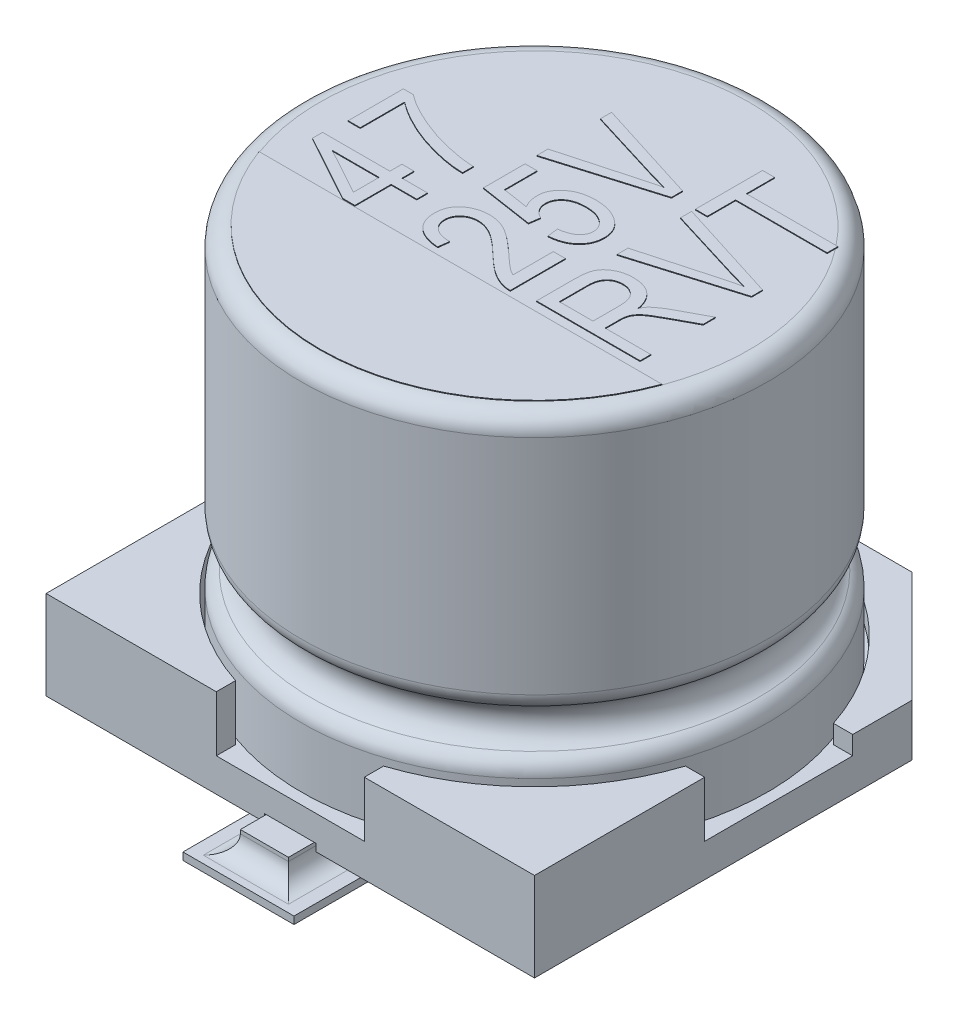
from build123d import *

# Parameters (mm, degrees)
SKETCH1_W                = 6.6
SKETCH1_H                = 6.6
BOSS_EXTRUDE1_DEPTH      = 1.2
CUT_EXTRUDE1_DEPTH       = 0.75
CUT_EXTRUDE2_DEPTH       = 5.902040392
CUT_EXTRUDE2_DEPTH_BACK  = 5.902040392
SKETCH3_W                = 3.3
SKETCH3_H                = 0.5
CHAMFER1_SIZE            = 1.5
CUT_EXTRUDE3_DEPTH       = 0.1
BOSS_EXTRUDE4_DEPTH      = 0.3
BOSS_EXTRUDE4_DEPTH_BACK = 0.1
SKETCH8_R                = 0.5
BOSS_EXTRUDE5_DEPTH      = 0.3
SKETCH9_W                = 1.5
SKETCH9_H                = 2
BOSS_EXTRUDE6_DEPTH      = 0.1
FILLET1_R                = 0.25
BOSS_EXTRUDE7_DEPTH      = 0.01


with BuildPart() as part:
    # Sketch1 → Boss-Extrude1 (new body)
    with BuildSketch(Plane(origin=(0, 0.3, 0), x_dir=(1, 0, 0), z_dir=(0, 1, 0))):
        Rectangle(SKETCH1_W, SKETCH1_H)
    extrude(amount=BOSS_EXTRUDE1_DEPTH)

    # Sketch2 → Cut-Extrude1 (cut)
    with BuildSketch(Plane(origin=(0, 1.5, 0), x_dir=(1, 0, 0), z_dir=(0, 1, 0))):
        with BuildLine():
            Line((-3.3, 1), (-3.039736831, 1))
            ThreePointArc((-3.039736831, 1), (-2.2627417, 2.2627417), (-1, 3.039736831))
            Line((-1, 3.039736831), (-1, 3.3))
            Line((-1, 3.3), (1, 3.3))
            Line((1, 3.3), (1, 3.039736831))
            ThreePointArc((1, 3.039736831), (2.2627417, 2.2627417), (3.039736831, 1))
            Line((3.039736831, 1), (3.3, 1))
            Line((3.3, 1), (3.3, -1))
            Line((3.3, -1), (3.039736831, -1))
            ThreePointArc((3.039736831, -1), (2.2627417, -2.2627417), (1, -3.039736831))
            Line((1, -3.039736831), (1, -3.3))
            Line((1, -3.3), (-1, -3.3))
            Line((-1, -3.3), (-1, -3.039736831))
            ThreePointArc((-1, -3.039736831), (-2.2627417, -2.2627417), (-3.039736831, -1))
            Line((-3.039736831, -1), (-3.3, -1))
            Line((-3.3, -1), (-3.3, 1))
        make_face()
    extrude(amount=-CUT_EXTRUDE1_DEPTH, mode=Mode.SUBTRACT)

    # Sketch3 → Cut-Extrude2 (cut, two sides: drawn at the far end of the back side and taken through both)
    with BuildSketch(Plane(origin=(0, 0, 0), x_dir=(0, 0, -1), z_dir=(1, 0, 0)).offset(-CUT_EXTRUDE2_DEPTH_BACK)):
        with Locations((1.65, 1.25)):
            Rectangle(SKETCH3_W, SKETCH3_H)
    extrude(amount=CUT_EXTRUDE2_DEPTH + CUT_EXTRUDE2_DEPTH_BACK, mode=Mode.SUBTRACT)

    # Chamfer1
    chamfer1_edges = [part.edges().sort_by_distance(p)[0] for p in [
        (3.3, 0.65, -3.3),
        (-3.3, 0.65, -3.3),
    ]]
    chamfer(chamfer1_edges, length=CHAMFER1_SIZE)

    # Sketch7 → Cut-Extrude3 (cut)
    with BuildSketch(Plane.XZ.offset(-0.3)):
        with BuildLine():
            Line((-0.35, 3.3), (0.35, 3.3))
            Line((0.35, 3.3), (0.498675617, 1.261367968))
            ThreePointArc((0.498675617, 1.261367968), (0, 0.725), (-0.498675617, 1.261367968))
            Line((-0.498675617, 1.261367968), (-0.35, 3.3))
        make_face()
        with BuildLine():
            Line((-0.35, -3.3), (0.35, -3.3))
            Line((0.35, -3.3), (0.498675617, -1.261367968))
            ThreePointArc((0.498675617, -1.261367968), (0, -0.725), (-0.498675617, -1.261367968))
            Line((-0.498675617, -1.261367968), (-0.35, -3.3))
        make_face()
    extrude(amount=-CUT_EXTRUDE3_DEPTH, mode=Mode.SUBTRACT)

    # Sketch6 → Boss-Extrude4 (add, two sides: drawn at the far end of the back side and taken through both)
    with BuildSketch(Plane.XZ.offset(-0.3).offset(-BOSS_EXTRUDE4_DEPTH_BACK)):
        with BuildLine():
            Line((-0.325, -1.225), (-0.325, -3.65))
            Line((-0.325, -3.65), (0.325, -3.65))
            Line((0.325, -3.65), (0.325, -1.225))
            ThreePointArc((0.325, -1.225), (0, -0.9), (-0.325, -1.225))
        make_face()
        with BuildLine():
            Line((-0.325, 1.225), (-0.325, 3.65))
            Line((-0.325, 3.65), (0.325, 3.65))
            Line((0.325, 3.65), (0.325, 1.225))
            ThreePointArc((0.325, 1.225), (0, 0.9), (-0.325, 1.225))
        make_face()
    extrude(amount=BOSS_EXTRUDE4_DEPTH + BOSS_EXTRUDE4_DEPTH_BACK)

    # Sketch8 → Boss-Extrude5 (add)
    with BuildSketch(Plane.XZ.offset(-0.3)):
        with Locations(Location((-2, 2, 0), (0, 0, 270))):
            Circle(SKETCH8_R)
        with Locations(Location((2, 2, 0), (0, 0, 270))):
            Circle(SKETCH8_R)
        with Locations(Location((2, -2, 0), (0, 0, 270))):
            Circle(SKETCH8_R)
        with Locations(Location((-2, -2, 0), (0, 0, 270))):
            Circle(SKETCH8_R)
    extrude(amount=BOSS_EXTRUDE5_DEPTH)

    # Sketch9 → Boss-Extrude6 (add)
    with BuildSketch(Plane(origin=(0, 0, 0), x_dir=(1, 0, 0), z_dir=(0, 1, 0))):
        with Locations((0, 3)):
            Rectangle(SKETCH9_W, SKETCH9_H)
        with Locations((0, -3)):
            Rectangle(SKETCH9_W, SKETCH9_H)
    extrude(amount=BOSS_EXTRUDE6_DEPTH)

    # Fillet1
    fillet1_edges = [part.edges().sort_by_distance(p)[0] for p in [
        (0.325, 0.1, -2.825),
        (0, 0.1, -3.65),
        (-0.325, 0.1, -2.825),
        (-0.325, 0.1, 2.825),
        (0, 0.1, 3.65),
        (0.325, 0.1, 2.825),
    ]]
    fillet(fillet1_edges, radius=FILLET1_R)


with BuildPart() as body_2:
    # Sketch4 → Revolve1 (revolve)
    with BuildSketch(Plane(origin=(0, 0, 0), x_dir=(0, 0, -1), z_dir=(1, 0, 0)), mode=Mode.PRIVATE) as revolve1_sk:
        with BuildLine():
            Line((0, 0.75), (0, 5.8))
            Line((0, 5.8), (-2.9, 5.8))
            ThreePointArc((-2.9, 5.8), (-3.076776695, 5.726776695), (-3.15, 5.55))
            Line((-3.15, 5.55), (-3.15, 2.539897949))
            ThreePointArc((-3.15, 2.539897949), (-3.113200716, 2.409339707), (-3.013636364, 2.317217063))
            ThreePointArc((-3.013636364, 2.317217063), (-2.85, 2.05), (-3.013636364, 1.782782937))
            ThreePointArc((-3.013636364, 1.782782937), (-3.113200716, 1.690660293), (-3.15, 1.560102051))
            Line((-3.15, 1.560102051), (-3.15, 0.75))
            Line((-3.15, 0.75), (0, 0.75))
        make_face()
    revolve(revolve1_sk.sketch.rotate(Axis((0, 0, 0), (0, 1, 0)), 180), axis=Axis((0, 0, 0), (0, 1, 0)))

    # Sketch10 → Boss-Extrude7 (add)
    # profile 1 of 9: a face of its own
    with BuildSketch(Plane(origin=(0, 5.8, 0), x_dir=(1, 0, 0), z_dir=(0, 1, 0))):
        with BuildLine():
            Line((-2.722131518, -1), (2.722131518, -1))
            ThreePointArc((2.722131518, -1), (0, -2.9), (-2.722131518, -1))
        make_face()
    # profile 2 of 9: a face of its own
    with BuildSketch(Plane(origin=(0, 5.8, 0), x_dir=(1, 0, 0), z_dir=(0, 1, 0))):
        Polygon((-1.1, -0.490909091), (-1.445454545, -0.490909091), (-1.445454545, -0.981818182), (-1.609090909, -0.981818182), (-2.518181818, -0.482670455), (-2.518181818, -0.345454545), (-1.609090909, -0.345454545), (-1.609090909, -0.181818182), (-1.445454545, -0.181818182), (-1.445454545, -0.345454545), (-1.1, -0.345454545), align=None)
        Polygon((-1.609090909, -0.490909091), (-2.241761364, -0.490909091), (-1.609090909, -0.838352273), align=None, mode=Mode.SUBTRACT)
    # profile 3 of 9: a face of its own
    with BuildSketch(Plane(origin=(0, 5.8, 0), x_dir=(1, 0, 0), z_dir=(0, 1, 0))):
        with BuildLine():
            Line((-2.318181818, -0.036363636), (-2.481818182, -0.036363636))
            Line((-2.481818182, -0.036363636), (-2.481818182, 0.709090909))
            Line((-2.481818182, 0.709090909), (-2.348011364, 0.709090909))
            add(Edge.make_bspline(
                [(-2.348011364, 0.709090909), (-2.329493997, 0.695259816), (-2.291802758, 0.667107268), (-2.231511589, 0.627736674), (-2.167300458, 0.589447284), (-2.099115474, 0.552202178), (-2.026735965, 0.516442976), (-1.950395077, 0.481792677), (-1.869863353, 0.448671938), (-1.786180255, 0.416771358), (-1.700509186, 0.387072726), (-1.614166454, 0.360699392), (-1.527962748, 0.337560436), (-1.441958888, 0.318119267), (-1.356259293, 0.301430866), (-1.270766825, 0.288433289), (-1.185381408, 0.278624638), (-1.128427711, 0.274690798), (-1.1, 0.272727273)],
                knots=[0, 0, 0, 0, 0.828228242, 1.685820058, 2.579325365, 3.507361607, 4.469713273, 5.472243924, 6.511632332, 7.590183537, 8.68180921, 9.76082494, 10.825356942, 11.880104434, 12.920528634, 13.95402052, 14.978775448, 16, 16, 16, 16], degree=3))
            Line((-1.1, 0.272727273), (-1.1, 0.127272727))
            add(Edge.make_bspline(
                [(-1.1, 0.127272727), (-1.114968384, 0.127721783), (-1.145503887, 0.128637858), (-1.192187637, 0.132321595), (-1.240736039, 0.136926159), (-1.291101377, 0.14395977), (-1.343309321, 0.152404131), (-1.397339203, 0.16282712), (-1.453308412, 0.174269157), (-1.530001628, 0.192613669), (-1.62599912, 0.218383212), (-1.739052852, 0.255716866), (-1.849665888, 0.297377526), (-1.956248385, 0.345139752), (-2.057722591, 0.395822213), (-2.151901767, 0.449612447), (-2.239097534, 0.503996466), (-2.292310728, 0.544126176), (-2.318181818, 0.563636364)],
                knots=[0, 0, 0, 0, 0.547560405, 1.117023226, 1.712128439, 2.330702075, 2.976322001, 3.646013224, 4.342857794, 5.065247493, 6.529539093, 7.976213993, 9.417556904, 10.850065343, 12.245478746, 13.563746768, 14.815546979, 16, 16, 16, 16], degree=3))
            Line((-2.318181818, 0.563636364), (-2.318181818, -0.036363636))
        make_face()
    # profile 4 of 9: a face of its own
    with BuildSketch(Plane(origin=(0, 5.8, 0), x_dir=(1, 0, 0), z_dir=(0, 1, 0))):
        with BuildLine():
            Line((0.436363636, -0.181818182), (0.6, -0.181818182))
            Line((0.6, -0.181818182), (0.6, -0.927272727))
            add(Edge.make_bspline(
                [(0.6, -0.927272727), (0.591473861, -0.927307242), (0.574199763, -0.92737717), (0.547863878, -0.925052284), (0.520890384, -0.920275608), (0.492919456, -0.914176275), (0.464318953, -0.905528107), (0.434949982, -0.894941063), (0.404885362, -0.882449608), (0.373948232, -0.867821951), (0.341836986, -0.85073411), (0.308706054, -0.830091775), (0.273939944, -0.806503171), (0.237972195, -0.779396799), (0.200460941, -0.749260325), (0.161579918, -0.715945027), (0.121115489, -0.679590037), (0.094239066, -0.65368301), (0.080397727, -0.640340909)],
                knots=[0, 0, 0, 0, 0.672196011, 1.361880106, 2.081368845, 2.831486093, 3.618364569, 4.435734711, 5.292876118, 6.184871288, 7.133796945, 8.159796293, 9.26180684, 10.446293416, 11.710635831, 13.056147575, 14.483918136, 16, 16, 16, 16], degree=3))
            add(Edge.make_bspline(
                [(0.080397727, -0.640340909), (0.064362729, -0.624838105), (0.033488588, -0.594988661), (-0.012098974, -0.552978419), (-0.054472047, -0.514807895), (-0.09439686, -0.481239711), (-0.131329649, -0.45167791), (-0.165217609, -0.425825067), (-0.196829804, -0.404916689), (-0.234026094, -0.382341586), (-0.278307687, -0.360819433), (-0.329924889, -0.34179263), (-0.379823364, -0.329498879), (-0.412720366, -0.328000332), (-0.428693182, -0.327272727)],
                knots=[0, 0, 0, 0, 1.312560889, 2.527233899, 3.64818266, 4.668586789, 5.596397896, 6.432357998, 7.175835261, 7.825761013, 8.992224112, 10.065918602, 11.060925749, 12, 12, 12, 12], degree=3))
            add(Edge.make_bspline(
                [(-0.428693182, -0.327272727), (-0.437511466, -0.327374155), (-0.454734496, -0.327572254), (-0.479886592, -0.330939934), (-0.50381126, -0.335740808), (-0.526676172, -0.34208599), (-0.548124534, -0.351058455), (-0.568306101, -0.361931274), (-0.58748668, -0.374364054), (-0.605000247, -0.388871949), (-0.620799928, -0.404730101), (-0.634944309, -0.421482723), (-0.64650537, -0.439412197), (-0.656081715, -0.458149046), (-0.663408979, -0.477805517), (-0.668899131, -0.498331952), (-0.672018106, -0.519791199), (-0.67248854, -0.534365371), (-0.672727273, -0.541761364)],
                knots=[0, 0, 0, 0, 1.164144409, 2.273695819, 3.345940663, 4.387378487, 5.402712487, 6.410231049, 7.41307794, 8.417484468, 9.408318902, 10.367853362, 11.308274301, 12.220303706, 13.142827832, 14.074469365, 15.022846069, 16, 16, 16, 16], degree=3))
            add(Edge.make_bspline(
                [(-0.672727273, -0.541761364), (-0.67256065, -0.549735789), (-0.672235395, -0.565302234), (-0.66816798, -0.58798478), (-0.662773189, -0.609744121), (-0.654244328, -0.630308269), (-0.64393617, -0.650068929), (-0.630480705, -0.668213205), (-0.615464229, -0.685784601), (-0.597847597, -0.701936563), (-0.577843958, -0.716354261), (-0.555995759, -0.729295972), (-0.531759102, -0.739727099), (-0.505732976, -0.748493339), (-0.477605795, -0.755379216), (-0.447464409, -0.759976594), (-0.415321715, -0.763349713), (-0.393191418, -0.763539056), (-0.381818182, -0.763636364)],
                knots=[0, 0, 0, 0, 0.928593091, 1.812656339, 2.680433, 3.537535669, 4.402074609, 5.272376737, 6.164676777, 7.094647554, 8.050991042, 9.035788945, 10.049325173, 11.121325706, 12.235436061, 13.420862991, 14.67452591, 16, 16, 16, 16], degree=3))
            Line((-0.381818182, -0.763636364), (-0.4, -0.909090909))
            add(Edge.make_bspline(
                [(-0.4, -0.909090909), (-0.416878864, -0.907591961), (-0.449624625, -0.904683933), (-0.497028868, -0.897053486), (-0.541012726, -0.886466967), (-0.582009501, -0.87389317), (-0.619529308, -0.858098246), (-0.654259092, -0.840320731), (-0.685594771, -0.819531651), (-0.71358887, -0.796165061), (-0.738135931, -0.770416762), (-0.759470498, -0.742754936), (-0.777973713, -0.713309743), (-0.792661358, -0.681666753), (-0.804113656, -0.648035286), (-0.812301557, -0.612540687), (-0.817184689, -0.575040843), (-0.817844532, -0.549446474), (-0.818181818, -0.536363636)],
                knots=[0, 0, 0, 0, 1.296016433, 2.514330702, 3.668705393, 4.754684394, 5.790583066, 6.778804856, 7.735156204, 8.660808185, 9.562568342, 10.450784178, 11.329227516, 12.217177451, 13.112894374, 14.042449809, 14.999377131, 16, 16, 16, 16], degree=3))
            add(Edge.make_bspline(
                [(-0.818181818, -0.536363636), (-0.81777024, -0.522237085), (-0.81696883, -0.494730344), (-0.811606791, -0.45470806), (-0.802364468, -0.417268646), (-0.788775473, -0.382683468), (-0.772086687, -0.350576525), (-0.751359855, -0.321238205), (-0.726718946, -0.294699063), (-0.698630231, -0.271102577), (-0.668318477, -0.250243504), (-0.636619301, -0.232044118), (-0.604062219, -0.216257213), (-0.570283829, -0.203919398), (-0.535737761, -0.193615982), (-0.499900262, -0.187143157), (-0.463184854, -0.182586333), (-0.438366747, -0.182075678), (-0.425852273, -0.181818182)],
                knots=[0, 0, 0, 0, 1.141316638, 2.222333051, 3.255980828, 4.24919085, 5.217781249, 6.173073686, 7.14226832, 8.135684626, 9.131102602, 10.111468148, 11.086834621, 12.050425614, 13.014198859, 13.995608887, 14.989290351, 16, 16, 16, 16], degree=3))
            add(Edge.make_bspline(
                [(-0.425852273, -0.181818182), (-0.41457728, -0.182060793), (-0.392174188, -0.182542853), (-0.358747505, -0.185678697), (-0.325770218, -0.191214046), (-0.292925237, -0.198401446), (-0.260721139, -0.208600438), (-0.228646367, -0.220146162), (-0.197063055, -0.234150534), (-0.165353596, -0.250681871), (-0.132400362, -0.270042705), (-0.097582813, -0.293222701), (-0.05999161, -0.319941246), (-0.020068327, -0.350742095), (0.022628597, -0.385133141), (0.067760296, -0.423558024), (0.115418934, -0.465887373), (0.147774758, -0.495686412), (0.164488636, -0.511079545)],
                knots=[0, 0, 0, 0, 0.780531358, 1.550893666, 2.321451189, 3.094347453, 3.876089108, 4.657940698, 5.453333384, 6.265487087, 7.132311241, 8.097757185, 9.160053187, 10.324349312, 11.587703087, 12.955031265, 14.427076445, 16, 16, 16, 16], degree=3))
            add(Edge.make_bspline(
                [(0.164488636, -0.511079545), (0.174879317, -0.520861385), (0.194736743, -0.539555267), (0.223540483, -0.565848432), (0.249372468, -0.589941919), (0.272886624, -0.611016769), (0.293579301, -0.62975731), (0.312127711, -0.645161778), (0.327628216, -0.658406993), (0.352466614, -0.677729847), (0.387502286, -0.70211597), (0.420452127, -0.719080527), (0.436363636, -0.727272727)],
                knots=[0, 0, 0, 0, 1.227426371, 2.345710398, 3.354421158, 4.265580894, 5.061720194, 5.755250507, 6.339260457, 6.815034732, 8.461977265, 10, 10, 10, 10], degree=3))
            Line((0.436363636, -0.727272727), (0.436363636, -0.181818182))
        make_face()
    # profile 5 of 9: a face of its own
    with BuildSketch(Plane(origin=(0, 5.8, 0), x_dir=(1, 0, 0), z_dir=(0, 1, 0))):
        with BuildLine():
            Line((0.218181818, -0.036363636), (0.2, 0.109090909))
            add(Edge.make_bspline(
                [(0.2, 0.109090909), (0.211101971, 0.110567587), (0.232737788, 0.113445378), (0.263885694, 0.119848382), (0.293064038, 0.126930845), (0.319651618, 0.136285915), (0.34447028, 0.146000707), (0.366780938, 0.157754603), (0.387216311, 0.170429338), (0.405044464, 0.184825644), (0.42111939, 0.19975374), (0.434636833, 0.215785653), (0.446561389, 0.232076172), (0.456229143, 0.249117635), (0.463723293, 0.266844238), (0.468775385, 0.285197267), (0.472033163, 0.304051607), (0.472494528, 0.316842721), (0.472727273, 0.323295455)],
                knots=[0, 0, 0, 0, 1.411589299, 2.750942728, 4.00771248, 5.193274551, 6.301848483, 7.364530321, 8.36815806, 9.328452501, 10.249032995, 11.129646394, 11.967965374, 12.7913576, 13.594060915, 14.387835106, 15.186711129, 16, 16, 16, 16], degree=3))
            add(Edge.make_bspline(
                [(0.472727273, 0.323295455), (0.47246113, 0.331363756), (0.471934427, 0.347331097), (0.46751459, 0.370816108), (0.460368895, 0.393421364), (0.450386963, 0.415271865), (0.43708047, 0.435936311), (0.421405758, 0.456119122), (0.402468066, 0.474980646), (0.381218628, 0.493183371), (0.357552586, 0.510017788), (0.331144397, 0.524080821), (0.302921326, 0.536308638), (0.27269317, 0.546702043), (0.240203605, 0.554209971), (0.20572194, 0.559481998), (0.169202922, 0.563055128), (0.1441377, 0.563438993), (0.13125, 0.563636364)],
                knots=[0, 0, 0, 0, 0.833503236, 1.64952068, 2.460650161, 3.279715081, 4.124353123, 4.995793989, 5.916428404, 6.881576056, 7.886415737, 8.911413223, 9.967990459, 11.063833818, 12.210651719, 13.409634283, 14.668120429, 16, 16, 16, 16], degree=3))
            add(Edge.make_bspline(
                [(0.13125, 0.563636364), (0.119216027, 0.563411231), (0.095769358, 0.56297259), (0.061609862, 0.559772504), (0.029473354, 0.554831228), (-0.000594739, 0.547469608), (-0.028423842, 0.537659446), (-0.054490961, 0.526502629), (-0.078298563, 0.512722984), (-0.099725125, 0.496779871), (-0.119111641, 0.479625248), (-0.135710672, 0.460896308), (-0.149925684, 0.441323642), (-0.161929936, 0.420707247), (-0.170475105, 0.398657339), (-0.177295763, 0.375820096), (-0.180872766, 0.351720796), (-0.181499254, 0.335331824), (-0.181818182, 0.326988636)],
                knots=[0, 0, 0, 0, 1.312040837, 2.556345105, 3.737883698, 4.854849349, 5.925960309, 6.952388988, 7.9424386, 8.917239489, 9.860521384, 10.760061641, 11.639947922, 12.495504232, 13.352616949, 14.212152034, 15.089854369, 16, 16, 16, 16], degree=3))
            add(Edge.make_bspline(
                [(-0.181818182, 0.326988636), (-0.181386991, 0.31691141), (-0.180526809, 0.296808367), (-0.173354012, 0.267203557), (-0.161919921, 0.238576183), (-0.145949551, 0.211277017), (-0.125781986, 0.186087196), (-0.101844533, 0.163424776), (-0.074502628, 0.143327785), (-0.054133578, 0.132693693), (-0.04375, 0.127272727)],
                knots=[0, 0, 0, 0, 0.943121662, 1.881431981, 2.836990949, 3.823036868, 4.833137184, 5.849762362, 6.903868453, 8, 8, 8, 8], degree=3))
            Line((-0.04375, 0.127272727), (-0.064488636, -0.018181818))
            Line((-0.064488636, -0.018181818), (-0.781818182, 0.090909091))
            Line((-0.781818182, 0.090909091), (-0.781818182, 0.654545455))
            Line((-0.781818182, 0.654545455), (-0.618181818, 0.654545455))
            Line((-0.618181818, 0.654545455), (-0.618181818, 0.212784091))
            Line((-0.618181818, 0.212784091), (-0.272443182, 0.160227273))
            add(Edge.make_bspline(
                [(-0.272443182, 0.160227273), (-0.280823021, 0.176613081), (-0.297407403, 0.209041926), (-0.314678944, 0.260640587), (-0.32533713, 0.313667947), (-0.326625365, 0.349571453), (-0.327272727, 0.367613636)],
                knots=[0, 0, 0, 0, 1.017619267, 2.013951072, 3.001973272, 4, 4, 4, 4], degree=3))
            add(Edge.make_bspline(
                [(-0.327272727, 0.367613636), (-0.326874523, 0.378906499), (-0.326083106, 0.401350674), (-0.320235417, 0.434343157), (-0.310874813, 0.466250024), (-0.297294668, 0.496922513), (-0.279916146, 0.526376693), (-0.258874387, 0.554832977), (-0.234130638, 0.58215363), (-0.205438517, 0.607756331), (-0.173874347, 0.631620275), (-0.139218461, 0.652454829), (-0.10193904, 0.670137284), (-0.061857834, 0.684168416), (-0.019379192, 0.695726579), (0.025894119, 0.703532212), (0.073772199, 0.708019966), (0.106524397, 0.708728234), (0.123295455, 0.709090909)],
                knots=[0, 0, 0, 0, 0.861018809, 1.711245113, 2.547675859, 3.391805506, 4.262674834, 5.151129072, 6.086914488, 7.068866089, 8.080081396, 9.100796714, 10.1476286, 11.221399762, 12.335728169, 13.501851446, 14.720800604, 16, 16, 16, 16], degree=3))
            add(Edge.make_bspline(
                [(0.123295455, 0.709090909), (0.139972763, 0.708744866), (0.172829781, 0.708063103), (0.221182639, 0.703234952), (0.267685748, 0.694930211), (0.312341106, 0.683620509), (0.355233532, 0.669108797), (0.396299037, 0.651153258), (0.435499753, 0.629784545), (0.472612172, 0.605560487), (0.506510629, 0.57857772), (0.53647709, 0.549082485), (0.561857129, 0.517280497), (0.582560215, 0.483088947), (0.598604448, 0.446704241), (0.609942787, 0.408034652), (0.616952086, 0.367110572), (0.617766217, 0.339043658), (0.618181818, 0.324715909)],
                knots=[0, 0, 0, 0, 1.144492614, 2.254837035, 3.330813134, 4.383755227, 5.413414698, 6.434919789, 7.455680344, 8.474121079, 9.472858394, 10.424138735, 11.353862604, 12.257787762, 13.159841921, 14.074912736, 15.017271142, 16, 16, 16, 16], degree=3))
            add(Edge.make_bspline(
                [(0.618181818, 0.324715909), (0.617828765, 0.312771431), (0.617133725, 0.289256917), (0.612395275, 0.254615174), (0.603577826, 0.221636349), (0.592442177, 0.189715236), (0.577096784, 0.15959834), (0.55888353, 0.130664995), (0.537105731, 0.103295459), (0.512134892, 0.077568051), (0.484458274, 0.053758215), (0.454005872, 0.032531418), (0.420992011, 0.014069776), (0.385306503, -0.001590372), (0.347111633, -0.014252186), (0.306479895, -0.024498815), (0.263297216, -0.032285998), (0.233456651, -0.03498306), (0.218181818, -0.036363636)],
                knots=[0, 0, 0, 0, 0.958689857, 1.887326147, 2.797936266, 3.6946441, 4.595336751, 5.504073741, 6.434636212, 7.396724143, 8.377688541, 9.360182663, 10.370759081, 11.408658253, 12.482955239, 13.5963024, 14.769591684, 16, 16, 16, 16], degree=3))
        make_face()
    # profile 6 of 9: a face of its own
    with BuildSketch(Plane(origin=(0, 5.8, 0), x_dir=(1, 0, 0), z_dir=(0, 1, 0))):
        with BuildLine():
            Line((0.6, 1.250852273), (-0.8, 0.832102273))
            Line((-0.8, 0.832102273), (-0.8, 0.981818182))
            Line((-0.8, 0.981818182), (0.215625, 1.261931818))
            add(Edge.make_bspline(
                [(0.215625, 1.261931818), (0.23502513, 1.267188611), (0.273113627, 1.277509333), (0.329419911, 1.291882434), (0.383540048, 1.305617864), (0.419023676, 1.314057553), (0.436363636, 1.318181818)],
                knots=[0, 0, 0, 0, 1.058778416, 2.078711773, 3.061114545, 4, 4, 4, 4], degree=3))
            add(Edge.make_bspline(
                [(0.436363636, 1.318181818), (0.400128509, 1.327526981), (0.326165891, 1.346602192), (0.252964299, 1.368417642), (0.215625, 1.379545455)],
                knots=[0, 0, 0, 0, 0.979822753, 2, 2, 2, 2], degree=3))
            Line((0.215625, 1.379545455), (-0.8, 1.690909091))
            Line((-0.8, 1.690909091), (-0.8, 1.842045455))
            Line((-0.8, 1.842045455), (0.6, 1.401136364))
            Line((0.6, 1.401136364), (0.6, 1.250852273))
        make_face()
    # profile 7 of 9: a face of its own
    with BuildSketch(Plane(origin=(0, 5.8, 0), x_dir=(1, 0, 0), z_dir=(0, 1, 0))):
        with BuildLine():
            Line((2.3, -0.872727273), (0.9, -0.872727273))
            Line((0.9, -0.872727273), (0.9, -0.358522727))
            add(Edge.make_bspline(
                [(0.9, -0.358522727), (0.900073763, -0.345546017), (0.900216539, -0.320428259), (0.902308959, -0.284044497), (0.905344787, -0.250202662), (0.909579597, -0.219012834), (0.914777868, -0.190483154), (0.921766894, -0.16473241), (0.929434889, -0.141402667), (0.942097141, -0.11394169), (0.962104286, -0.08285306), (0.991986148, -0.049045543), (1.029113573, -0.019546227), (1.071726678, 0.006727276), (1.11958402, 0.028297408), (1.17177175, 0.043578157), (1.22760849, 0.052802429), (1.266062455, 0.053954341), (1.285795455, 0.054545455)],
                knots=[0, 0, 0, 0, 0.957632509, 1.853596319, 2.688865688, 3.464800978, 4.176232129, 4.827248354, 5.432859936, 5.986426289, 7.054779681, 8.148885667, 9.301586196, 10.541074307, 11.836203864, 13.163061816, 14.544199576, 16, 16, 16, 16], degree=3))
            add(Edge.make_bspline(
                [(1.285795455, 0.054545455), (1.298871698, 0.054235333), (1.32441369, 0.053629569), (1.361855278, 0.049987367), (1.397440244, 0.043563031), (1.430988976, 0.034018043), (1.462814114, 0.022553984), (1.492482956, 0.007839851), (1.520425409, -0.009159596), (1.546408208, -0.028871174), (1.570251677, -0.051075165), (1.592091252, -0.075549512), (1.611022928, -0.102851103), (1.628180904, -0.132133088), (1.642985373, -0.163902878), (1.65548257, -0.198004739), (1.665367052, -0.234558689), (1.67023708, -0.259813647), (1.672727273, -0.272727273)],
                knots=[0, 0, 0, 0, 1.121876415, 2.19137531, 3.223949102, 4.219388443, 5.180726412, 6.121767895, 7.055309798, 7.98310721, 8.914383918, 9.846793912, 10.791230962, 11.759648879, 12.755485972, 13.793860249, 14.871933835, 16, 16, 16, 16], degree=3))
            add(Edge.make_bspline(
                [(1.672727273, -0.272727273), (1.677972871, -0.263164174), (1.687983581, -0.244913937), (1.704620081, -0.220357649), (1.720557857, -0.198837772), (1.732437343, -0.186905744), (1.738068182, -0.18125)],
                knots=[0, 0, 0, 0, 1.159024517, 2.21188481, 3.152438931, 4, 4, 4, 4], degree=3))
            add(Edge.make_bspline(
                [(1.738068182, -0.18125), (1.751761893, -0.169905132), (1.779303299, -0.147087825), (1.82324216, -0.115808927), (1.868950866, -0.085847863), (1.901104584, -0.068253316), (1.917329545, -0.059375)],
                knots=[0, 0, 0, 0, 0.982253192, 1.975551771, 2.978451105, 4, 4, 4, 4], degree=3))
            Line((1.917329545, -0.059375), (2.3, 0.145454545))
            Line((2.3, 0.145454545), (2.3, -0.019886364))
            Line((2.3, -0.019886364), (2.000568182, -0.181534091))
            add(Edge.make_bspline(
                [(2.000568182, -0.181534091), (1.986528238, -0.189064398), (1.959673176, -0.203468078), (1.921542639, -0.224844268), (1.887155621, -0.244716202), (1.856473931, -0.26304488), (1.829837697, -0.28011911), (1.806835821, -0.29541567), (1.787807022, -0.309583774), (1.767901985, -0.326061224), (1.747867101, -0.345925096), (1.727397014, -0.368993525), (1.711579168, -0.392199546), (1.699513707, -0.415799766), (1.691569692, -0.441785471), (1.685622134, -0.471064256), (1.682387461, -0.504948189), (1.682015972, -0.528971003), (1.681818182, -0.541761364)],
                knots=[0, 0, 0, 0, 1.483604313, 2.837780862, 4.070509745, 5.182094193, 6.165504003, 7.016659521, 7.753887315, 8.373758725, 9.421416007, 10.377927395, 11.24132908, 12.030078718, 12.836042303, 13.763032878, 14.808981517, 16, 16, 16, 16], degree=3))
            Line((1.681818182, -0.541761364), (1.681818182, -0.727272727))
            Line((1.681818182, -0.727272727), (2.3, -0.727272727))
            Line((2.3, -0.727272727), (2.3, -0.872727273))
        make_face()
        with BuildLine():
            Line((1.518181818, -0.727272727), (1.518181818, -0.386079545))
            add(Edge.make_bspline(
                [(1.518181818, -0.386079545), (1.51784038, -0.368551478), (1.517200491, -0.33570217), (1.512950466, -0.289746201), (1.505260087, -0.250520807), (1.494057811, -0.217296065), (1.479219373, -0.188958415), (1.460827249, -0.164309705), (1.438869635, -0.14255013), (1.413289498, -0.12443297), (1.385178927, -0.108949222), (1.354131271, -0.098784902), (1.321145845, -0.091792043), (1.298334339, -0.0912082), (1.286647727, -0.090909091)],
                knots=[0, 0, 0, 0, 1.473137061, 2.760802605, 3.873686451, 4.825077919, 5.697275026, 6.550455577, 7.400251438, 8.283812568, 9.177530931, 10.086115457, 11.019493646, 12, 12, 12, 12], degree=3))
            add(Edge.make_bspline(
                [(1.286647727, -0.090909091), (1.278213117, -0.091167916), (1.261769623, -0.091672503), (1.237673197, -0.0944289), (1.215017199, -0.0995137), (1.19372088, -0.106728841), (1.173827875, -0.115709596), (1.155330151, -0.126983949), (1.138402828, -0.140382054), (1.122625811, -0.155455071), (1.108512425, -0.172607295), (1.096745483, -0.19208158), (1.086418458, -0.213266004), (1.077823559, -0.236448353), (1.071407677, -0.261698229), (1.066974643, -0.288890824), (1.064002815, -0.317926589), (1.063761011, -0.337965593), (1.063636364, -0.348295455)],
                knots=[0, 0, 0, 0, 1.044922679, 2.037104192, 2.998871072, 3.914999749, 4.817741419, 5.696780486, 6.590716951, 7.486574954, 8.395164589, 9.332593663, 10.297787276, 11.310892337, 12.389055078, 13.518989792, 14.721069654, 16, 16, 16, 16], degree=3))
            Line((1.063636364, -0.348295455), (1.063636364, -0.727272727))
            Line((1.063636364, -0.727272727), (1.518181818, -0.727272727))
        make_face(mode=Mode.SUBTRACT)
    # profile 8 of 9: a face of its own
    with BuildSketch(Plane(origin=(0, 5.8, 0), x_dir=(1, 0, 0), z_dir=(0, 1, 0))):
        with BuildLine():
            Line((2.3, 0.632670455), (0.9, 0.213920455))
            Line((0.9, 0.213920455), (0.9, 0.363636364))
            Line((0.9, 0.363636364), (1.915625, 0.64375))
            add(Edge.make_bspline(
                [(1.915625, 0.64375), (1.93502513, 0.649006793), (1.973113627, 0.659327515), (2.029419911, 0.673700615), (2.083540048, 0.687436046), (2.119023676, 0.695875735), (2.136363636, 0.7)],
                knots=[0, 0, 0, 0, 1.058778416, 2.078711773, 3.061114545, 4, 4, 4, 4], degree=3))
            add(Edge.make_bspline(
                [(2.136363636, 0.7), (2.100128509, 0.709345163), (2.026165891, 0.728420374), (1.952964299, 0.750235824), (1.915625, 0.761363636)],
                knots=[0, 0, 0, 0, 0.979822753, 2, 2, 2, 2], degree=3))
            Line((1.915625, 0.761363636), (0.9, 1.072727273))
            Line((0.9, 1.072727273), (0.9, 1.223863636))
            Line((0.9, 1.223863636), (2.3, 0.782954545))
            Line((2.3, 0.782954545), (2.3, 0.632670455))
        make_face()
    # profile 9 of 9: a face of its own
    with BuildSketch(Plane(origin=(0, 5.8, 0), x_dir=(1, 0, 0), z_dir=(0, 1, 0))):
        Polygon((2.3, 1.654545455), (1.063636364, 1.654545455), (1.063636364, 1.272727273), (0.9, 1.272727273), (0.9, 2.181818182), (1.063636364, 2.181818182), (1.063636364, 1.8), (2.3, 1.8), align=None)
    extrude(amount=BOSS_EXTRUDE7_DEPTH)


solid = Compound([part.part, body_2.part])
